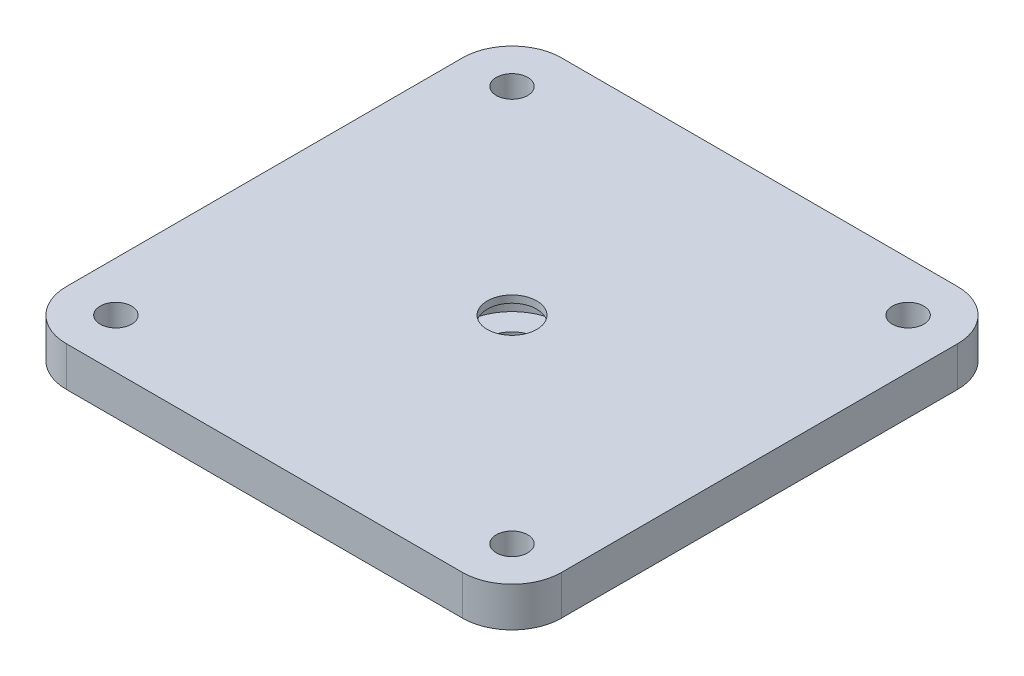
from build123d import *

# Parameters (mm, degrees)
SKETCH1_R           = 12.7
SKETCH1_R_2         = 3.175
BOSS_EXTRUDE1_DEPTH = 10
SKETCH1_3_R         = 12.7
SKETCH1_3_R_2       = 6.35
BOSS_EXTRUDE2_DEPTH = 2.5
SKETCH2_R           = 12.7
BOSS_EXTRUDE3_DEPTH = 10
SKETCH3_R           = 5
CUT_EXTRUDE3_DEPTH  = 10
CUT_EXTRUDE4_START  = -1.45
SKETCH4_R           = 10
CUT_EXTRUDE4_DEPTH  = 5
CUT_EXTRUDE5_DEPTH  = 2


with BuildPart() as part:
    # Sketch1 → Boss-Extrude1 (new body)
    with BuildSketch(Plane(origin=(0, 0, 0), x_dir=(1, 0, 0), z_dir=(0, 1, 0))):
        with BuildLine():
            Line((-41.199040767, 52.757793765), (38.800959233, 52.757793765))
            ThreePointArc((38.800959233, 52.757793765), (45.872027044, 49.828861577), (48.800959233, 42.757793765))
            Line((48.800959233, 42.757793765), (48.800959233, -37.242206235))
            ThreePointArc((48.800959233, -37.242206235), (45.872027044, -44.313274047), (38.800959233, -47.242206235))
            Line((38.800959233, -47.242206235), (-41.199040767, -47.242206235))
            ThreePointArc((-41.199040767, -47.242206235), (-48.270108579, -44.313274047), (-51.199040767, -37.242206235))
            Line((-51.199040767, -37.242206235), (-51.199040767, 42.757793765))
            ThreePointArc((-51.199040767, 42.757793765), (-48.270108579, 49.828861577), (-41.199040767, 52.757793765))
        make_face()
        with Locations(Location((0, 0, 0), (0, 0, 270))):
            Circle(SKETCH1_R, mode=Mode.SUBTRACT)
        with Locations(Location((-41.199040767, 42.757793765, 0), (0, 0, 270))):
            Circle(SKETCH1_R_2, mode=Mode.SUBTRACT)
        with Locations(Location((38.800959233, 42.757793765, 0), (0, 0, 270))):
            Circle(SKETCH1_R_2, mode=Mode.SUBTRACT)
        with Locations(Location((38.800959233, -37.242206235, 0), (0, 0, 270))):
            Circle(SKETCH1_R_2, mode=Mode.SUBTRACT)
        with Locations(Location((-41.199040767, -37.242206235, 0), (0, 0, 270))):
            Circle(SKETCH1_R_2, mode=Mode.SUBTRACT)
    extrude(amount=BOSS_EXTRUDE1_DEPTH)

    # Sketch1<3> → Boss-Extrude2 (add)
    with BuildSketch(Plane(origin=(0, 0, 0), x_dir=(1, 0, 0), z_dir=(0, 1, 0))):
        with Locations(Location((0, 0, 0), (0, 0, 270))):
            Circle(SKETCH1_3_R)
        with Locations(Location((0, 0, 0), (0, 0, 270))):
            Circle(SKETCH1_3_R_2, mode=Mode.SUBTRACT)
    extrude(amount=BOSS_EXTRUDE2_DEPTH)

    # Sketch2 → Boss-Extrude3 (add, through all)
    with BuildSketch(Plane(origin=(0, 10, 0), x_dir=(1, 0, 0), z_dir=(0, 1, 0))):
        Circle(SKETCH2_R)
    extrude(amount=-BOSS_EXTRUDE3_DEPTH)

    # Sketch3 → Cut-Extrude3 (cut)
    with BuildSketch(Plane(origin=(0, 10, 0), x_dir=(1, 0, 0), z_dir=(0, 1, 0))):
        with Locations(Location((-1.199040767, 2.757793765, 0), (0, 0, 270))):
            Circle(SKETCH3_R)
    extrude(amount=-CUT_EXTRUDE3_DEPTH, mode=Mode.SUBTRACT)

    # Sketch4 → Cut-Extrude4 (cut)
    with BuildSketch(Plane(origin=(0, 10, 0), x_dir=(1, 0, 0), z_dir=(0, 1, 0)).offset(CUT_EXTRUDE4_START)):
        with Locations(Location((-1.199040767, 2.757793765, 0), (0, 0, 270))):
            Circle(SKETCH4_R)
    extrude(amount=-CUT_EXTRUDE4_DEPTH, mode=Mode.SUBTRACT)

    # Sketch6 → Cut-Extrude5 (cut)
    with BuildSketch(Plane.XZ):
        with BuildLine():
            Line((48.800959233, -42.757793765), (48.800959233, 37.242206235))
            ThreePointArc((48.800959233, 37.242206235), (45.872027044, 44.313274047), (38.800959233, 47.242206235))
            Line((38.800959233, 47.242206235), (-41.199040767, 47.242206235))
            ThreePointArc((-41.199040767, 47.242206235), (-48.270108579, 44.313274047), (-51.199040767, 37.242206235))
            Line((-51.199040767, 37.242206235), (-51.199040767, -42.757793765))
            ThreePointArc((-51.199040767, -42.757793765), (-48.270108579, -49.828861577), (-41.199040767, -52.757793765))
            Line((-41.199040767, -52.757793765), (38.800959233, -52.757793765))
            ThreePointArc((38.800959233, -52.757793765), (45.872027044, -49.828861577), (48.800959233, -42.757793765))
        make_face()
    extrude(amount=-CUT_EXTRUDE5_DEPTH, mode=Mode.SUBTRACT)


solid = part.part
